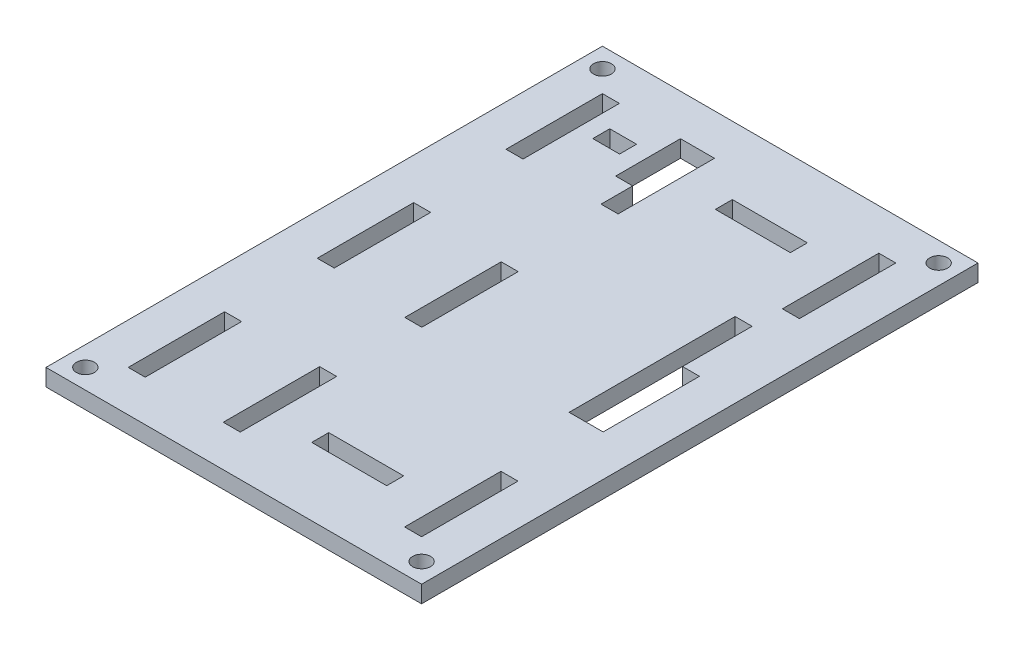
from build123d import *

# Parameters (mm, degrees)
SKETCH2_W           = 54.7846
SKETCH2_H           = 88.551
BOSS_EXTRUDE1_DEPTH = 3.175
SKETCH7_W           = 3.175
SKETCH7_H           = 18
SKETCH7_W_2         = 5
SKETCH7_H_2         = 3.175
SKETCH7_H_3         = 12.1
SKETCH7_W_3         = 14
CUT_EXTRUDE1_DEPTH  = 10
SKETCH8_W           = 62.7846
SKETCH8_H           = 96.551
SKETCH8_W_2         = 54.7846
SKETCH8_H_2         = 88.551
BOSS_EXTRUDE2_DEPTH = 3.175
SKETCH12_R          = 3.675
SKETCH12_R_2        = 1.675
BOSS_EXTRUDE4_DEPTH = 3.175
SKETCH13_R          = 1.675
CUT_EXTRUDE4_DEPTH  = 10
BOSS_EXTRUDE5_DEPTH = 3.175


with BuildPart() as part:
    # Sketch2 → Boss-Extrude1 (new body)
    with BuildSketch(Plane(origin=(0, 0, 0), x_dir=(1, 0, 0), z_dir=(0, 1, 0))):
        Rectangle(SKETCH2_W, SKETCH2_H)
    extrude(amount=BOSS_EXTRUDE1_DEPTH)

    # Sketch7 → Cut-Extrude1 (cut)
    with BuildSketch(Plane(origin=(0, 3.175, 0), x_dir=(1, 0, 0), z_dir=(0, 1, 0))):
        with Locations((-25.8048, 35.2755)):
            Rectangle(SKETCH7_W, SKETCH7_H)
        with Locations((-18.5173, 37.688)):
            Rectangle(SKETCH7_W_2, SKETCH7_H_2)
        with Locations((-11.2298, 38.2255)):
            Rectangle(SKETCH7_W, SKETCH7_H_3)
        Polygon((-6.4673, 44.2755), (-9.6423, 44.2755), (-9.6423, 32.1755), (-9.6423, 26.2755), (-6.4673, 26.2755), align=None)
        with Locations((8.875, 37.688)):
            Rectangle(SKETCH7_W_3, SKETCH7_H_2)
        with Locations((25.8048, 35.2755)):
            Rectangle(SKETCH7_W, SKETCH7_H)
        Polygon((24.2173, -10.3745), (24.2173, 7.6255), (24.2173, 20.6255), (21.0423, 20.6255), (21.0423, -10.3745), align=None)
        with Locations((25.8048, -1.3745)):
            Rectangle(SKETCH7_W, SKETCH7_H)
        with Locations((-8.0548, -1.3745)):
            Rectangle(SKETCH7_W, SKETCH7_H)
        with Locations((-25.8048, 0.0255)):
            Rectangle(SKETCH7_W, SKETCH7_H)
        with Locations((-25.8048, -35.2755)):
            Rectangle(SKETCH7_W, SKETCH7_H)
        with Locations((-8.0548, -35.2755)):
            Rectangle(SKETCH7_W, SKETCH7_H)
        with Locations((8.875, -37.688)):
            Rectangle(SKETCH7_W_3, SKETCH7_H_2)
        with Locations((25.8048, -35.2755)):
            Rectangle(SKETCH7_W, SKETCH7_H)
    extrude(amount=-CUT_EXTRUDE1_DEPTH, mode=Mode.SUBTRACT)

    # Sketch8 → Boss-Extrude2 (add)
    with BuildSketch(Plane(origin=(0, 3.175, 0), x_dir=(1, 0, 0), z_dir=(0, 1, 0))):
        Rectangle(SKETCH8_W, SKETCH8_H)
        Rectangle(SKETCH8_W_2, SKETCH8_H_2, mode=Mode.SUBTRACT)
    extrude(amount=-BOSS_EXTRUDE2_DEPTH)

    # Sketch12 → Boss-Extrude4 (add)
    # profile 1 of 4: a face of its own
    with BuildSketch(Plane(origin=(0, 3.175, 0), x_dir=(1, 0, 0), z_dir=(0, 1, 0))):
        with Locations((-31.3923, -48.2755)):
            Circle(SKETCH12_R)
        with Locations((-31.3923, -48.2755)):
            Circle(SKETCH12_R_2, mode=Mode.SUBTRACT)
    # profile 2 of 4: a face of its own
    with BuildSketch(Plane(origin=(0, 3.175, 0), x_dir=(1, 0, 0), z_dir=(0, 1, 0))):
        with Locations((31.3923, -48.2755)):
            Circle(SKETCH12_R)
        with Locations((31.3923, -48.2755)):
            Circle(SKETCH12_R_2, mode=Mode.SUBTRACT)
    # profile 3 of 4: a face of its own
    with BuildSketch(Plane(origin=(0, 3.175, 0), x_dir=(1, 0, 0), z_dir=(0, 1, 0))):
        with Locations((31.3923, 48.2755)):
            Circle(SKETCH12_R)
        with Locations((31.3923, 48.2755)):
            Circle(SKETCH12_R_2, mode=Mode.SUBTRACT)
    # profile 4 of 4: a face of its own
    with BuildSketch(Plane(origin=(0, 3.175, 0), x_dir=(1, 0, 0), z_dir=(0, 1, 0))):
        with Locations((-31.3923, 48.2755)):
            Circle(SKETCH12_R)
        with Locations((-31.3923, 48.2755)):
            Circle(SKETCH12_R_2, mode=Mode.SUBTRACT)
    extrude(amount=-BOSS_EXTRUDE4_DEPTH)

    # Sketch13 → Cut-Extrude4 (cut)
    with BuildSketch(Plane(origin=(0, 3.175, 0), x_dir=(1, 0, 0), z_dir=(0, 1, 0))):
        with Locations(Location((-31.3923, 48.2755, 0), (0, 0, 270))):
            Circle(SKETCH13_R)
        with Locations(Location((31.3923, 48.2755, 0), (0, 0, 270))):
            Circle(SKETCH13_R)
        with Locations(Location((31.3923, -48.2755, 0), (0, 0, 270))):
            Circle(SKETCH13_R)
        with Locations(Location((-31.3923, -48.2755, 0), (0, 0, 270))):
            Circle(SKETCH13_R)
    extrude(amount=-CUT_EXTRUDE4_DEPTH, mode=Mode.SUBTRACT)

    # Sketch14 → Boss-Extrude5 (add)
    with BuildSketch(Plane(origin=(0, 3.175, 0), x_dir=(1, 0, 0), z_dir=(0, 1, 0))):
        with BuildLine():
            Line((-35.0673, 48.2755), (-35.0673, -48.2755))
            ThreePointArc((-35.0673, -48.2755), (-33.990917421, -45.676882579), (-31.3923, -44.6005))
            Line((-31.3923, -44.6005), (-31.3923, 44.6005))
            ThreePointArc((-31.3923, 44.6005), (-33.990917421, 45.676882579), (-35.0673, 48.2755))
        make_face()
        with BuildLine():
            Line((31.392300042, 51.9505), (-31.3923, 51.9505))
            ThreePointArc((-31.3923, 51.9505), (-28.793682579, 50.874117421), (-27.7173, 48.2755))
            Line((-27.7173, 48.2755), (27.7173, 48.2755))
            ThreePointArc((27.7173, 48.2755), (28.793682594, 50.874117436), (31.392300042, 51.9505))
        make_face()
        with BuildLine():
            Line((-35.0673, 51.9505), (-35.0673, 48.2755))
            ThreePointArc((-35.0673, 48.2755), (-33.990917421, 50.874117421), (-31.3923, 51.9505))
            Line((-31.3923, 51.9505), (-35.0673, 51.9505))
        make_face()
        with BuildLine():
            ThreePointArc((31.3923, -44.6005), (33.990917421, -45.676882579), (35.0673, -48.2755))
            Line((35.0673, -48.2755), (35.0673, 48.2755))
            ThreePointArc((35.0673, 48.2755), (33.990917421, 45.676882579), (31.3923, 44.6005))
            Line((31.3923, 44.6005), (31.3923, -44.6005))
        make_face()
        with BuildLine():
            ThreePointArc((31.392300042, 51.9505), (33.990917436, 50.874117406), (35.0673, 48.2755))
            Line((35.0673, 48.2755), (35.0673, 51.9505))
            Line((35.0673, 51.9505), (31.392300042, 51.9505))
        make_face()
        with BuildLine():
            ThreePointArc((35.0673, -48.2755), (33.990917421, -50.874117421), (31.3923, -51.9505))
            Line((31.3923, -51.9505), (35.0673, -51.9505))
            Line((35.0673, -51.9505), (35.0673, -48.2755))
        make_face()
        with BuildLine():
            ThreePointArc((-27.7173, -48.2755), (-28.793682579, -50.874117421), (-31.3923, -51.9505))
            Line((-31.3923, -51.9505), (31.3923, -51.9505))
            ThreePointArc((31.3923, -51.9505), (28.793682579, -50.874117421), (27.7173, -48.2755))
            Line((27.7173, -48.2755), (-27.7173, -48.2755))
        make_face()
        with BuildLine():
            Line((-35.0673, -48.2755), (-35.0673, -51.9505))
            Line((-35.0673, -51.9505), (-31.3923, -51.9505))
            ThreePointArc((-31.3923, -51.9505), (-33.990917421, -50.874117421), (-35.0673, -48.2755))
        make_face()
    extrude(amount=-BOSS_EXTRUDE5_DEPTH)


solid = part.part
